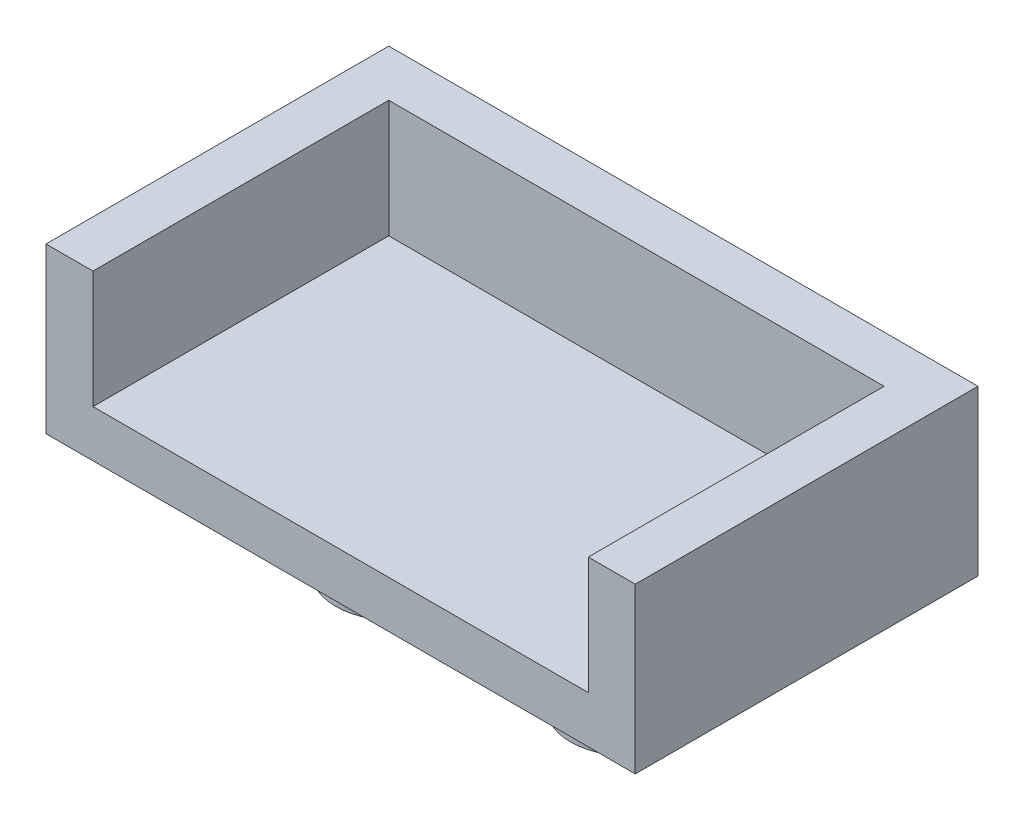
from build123d import *

# Parameters (mm, degrees)
BOSS_EXTRUDE1_DEPTH = 5
SKETCH1_3_W         = 25.1
SKETCH1_3_H         = 14.6
BOSS_EXTRUDE2_DEPTH = 2
SKETCH3_R           = 2.5
BOSS_EXTRUDE4_DEPTH = 5


with BuildPart() as part:
    # Sketch1 → Boss-Extrude1 (new body)
    with BuildSketch(Plane(origin=(0, 0, 0), x_dir=(1, 0, 0), z_dir=(0, 1, 0))):
        Polygon((23.1, 14.6), (-2, 14.6), (-2, 0), (0, 0), (0, 12.6), (21.1, 12.6), (21.1, 0), (23.1, 0), align=None)
    extrude(amount=BOSS_EXTRUDE1_DEPTH)

    # Sketch1<3> → Boss-Extrude2 (add)
    with BuildSketch(Plane(origin=(0, 0, 0), x_dir=(1, 0, 0), z_dir=(0, 1, 0))):
        with Locations((10.55, 7.3)):
            Rectangle(SKETCH1_3_W, SKETCH1_3_H)
    extrude(amount=-BOSS_EXTRUDE2_DEPTH)

    # Sketch3 → Boss-Extrude4 (add)
    with BuildSketch(Plane.XZ.offset(2)):
        with Locations((5.55, -7.3)):
            Circle(SKETCH3_R)
        with Locations((15.55, -7.3)):
            Circle(SKETCH3_R)
    extrude(amount=BOSS_EXTRUDE4_DEPTH)


solid = part.part
